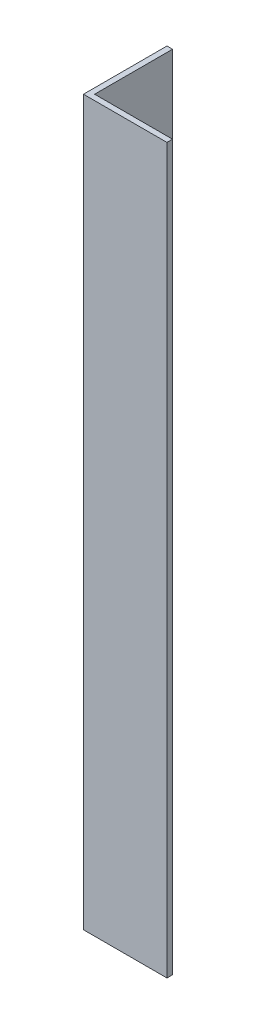
from build123d import *

# Parameters (mm, degrees)
SKETCH_1_W      = 15
SKETCH_1_H      = 1
EXTRUDE_1_DEPTH = 130
SKETCH_3_W      = 1
SKETCH_3_H      = 130
EXTRUDE_2_DEPTH = 14


with BuildPart() as part:
    # ｽｹｯﾁ1 → ﾎﾞｽ - 押し出し1 (new body)
    with BuildSketch(Plane(origin=(0, 0, 0), x_dir=(1, 0, 0), z_dir=(0, 1, 0))):
        with Locations((7.5, -0.5)):
            Rectangle(SKETCH_1_W, SKETCH_1_H)
    extrude(amount=EXTRUDE_1_DEPTH)

    # ｽｹｯﾁ3 → ﾎﾞｽ - 押し出し2 (add)
    with BuildSketch(Plane(origin=(0, 0, 0), x_dir=(-1, 0, 0), z_dir=(0, 0, -1))):
        with Locations((-0.5, 65)):
            Rectangle(SKETCH_3_W, SKETCH_3_H)
    extrude(amount=EXTRUDE_2_DEPTH)


solid = part.part
